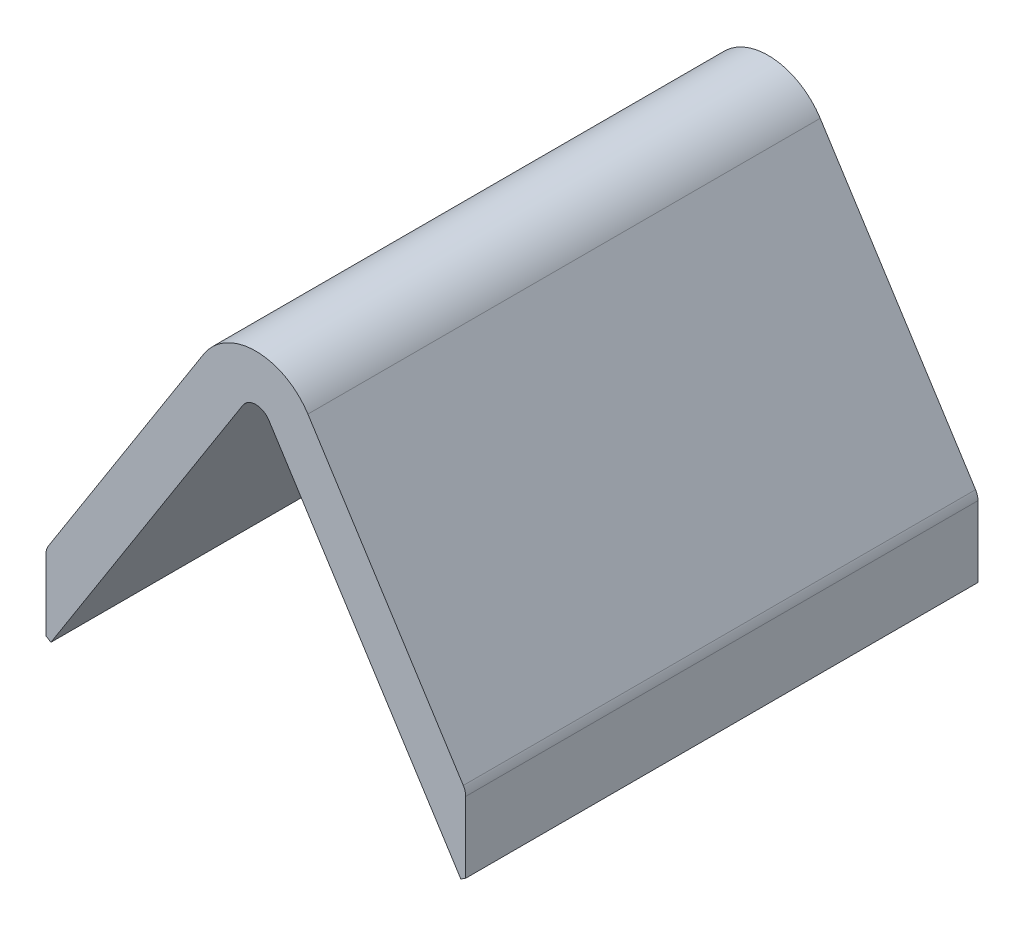
from build123d import *

# Parameters (mm, degrees)
BOSS_EXTRUDE1_DEPTH = 166


with BuildPart() as part:
    # Sketch1 → Boss-Extrude1 (new body)
    with BuildSketch(Plane.XY):
        with BuildLine():
            Line((-68, 14.557655487), (-66.418275512, 13.549985855))
            Line((-66.418275512, 13.549985855), (-4.216957229, 111.186498042))
            ThreePointArc((-4.216957229, 111.186498042), (0, 113.5), (4.216957229, 111.186498042))
            Line((4.216957229, 111.186498042), (66.418275512, 13.549985855))
            Line((66.418275512, 13.549985855), (68, 14.557655487))
            Line((68, 14.557655487), (68, 37.527193592))
            ThreePointArc((68, 37.527193592), (67.800249272, 38.926338662), (67.216957229, 40.213691634))
            Line((67.216957229, 40.213691634), (16.867828916, 119.245992167))
            ThreePointArc((16.867828916, 119.245992167), (0, 128.5), (-16.867828916, 119.245992167))
            Line((-16.867828916, 119.245992167), (-67.216957229, 40.213691634))
            ThreePointArc((-67.216957229, 40.213691634), (-67.800249272, 38.926338662), (-68, 37.527193592))
            Line((-68, 37.527193592), (-68, 14.557655487))
        make_face()
    extrude(amount=BOSS_EXTRUDE1_DEPTH)


solid = part.part
